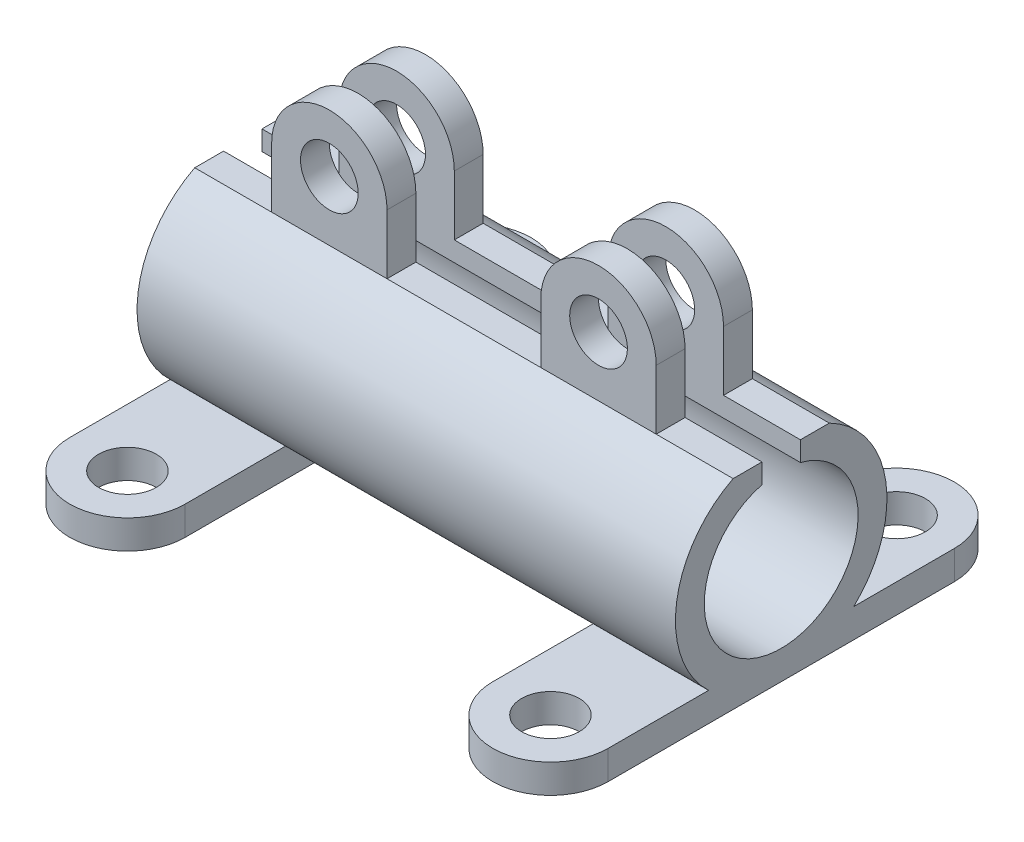
from build123d import *

# Parameters (mm, degrees)
SKETCH2_R               = 15
BOSS_EXTRUDE1_DEPTH     = 15
BOSS_EXTRUDE1_2_DEPTH   = 15
BOSS_EXTRUDE2_DEPTH     = 140
CUT_EXTRUDE2_DEPTH      = 261.480325553
CUT_EXTRUDE2_DEPTH_BACK = 261.480325553
SKETCH4_R               = 15


with BuildPart() as part:
    # Sketch2 → Boss-Extrude1 (new body)
    with BuildSketch(Plane(origin=(0, 0, 0), x_dir=(1, 0, 0), z_dir=(0, 1, 0))):
        with BuildLine():
            Line((-140, -90), (-140, 90))
            ThreePointArc((-140, 90), (-110, 120), (-80, 90))
            Line((-80, 90), (-80, -90))
            ThreePointArc((-80, -90), (-110, -120), (-140, -90))
        make_face()
        with Locations(Location((-110, 90, 0), (0, 0, 270))):
            Circle(SKETCH2_R, mode=Mode.SUBTRACT)
        with Locations(Location((-110, -90, 0), (0, 0, 270))):
            Circle(SKETCH2_R, mode=Mode.SUBTRACT)
    extrude(amount=BOSS_EXTRUDE1_DEPTH)



with BuildPart() as body_2:
    # Sketch2 → Boss-Extrude1 2 (new body)
    with BuildSketch(Plane(origin=(0, 0, 0), x_dir=(1, 0, 0), z_dir=(0, 1, 0))):
        with BuildLine():
            Line((140, -90), (140, 90))
            ThreePointArc((140, 90), (110, 120), (80, 90))
            Line((80, 90), (80, -90))
            ThreePointArc((80, -90), (110, -120), (140, -90))
        make_face()
        with Locations(Location((110, -90, 0), (0, 0, 90))):
            Circle(SKETCH2_R, mode=Mode.SUBTRACT)
        with Locations(Location((110, 90, 0), (0, 0, 90))):
            Circle(SKETCH2_R, mode=Mode.SUBTRACT)
    extrude(amount=BOSS_EXTRUDE1_2_DEPTH)


with BuildPart() as part_1:
    add(part.part)

    add(body_2.part)  # Boss-Extrude2 merges body 2
    # Sketch3 → Boss-Extrude2 (add, symmetric)
    with BuildSketch(Plane(origin=(0, 0, 0), x_dir=(0, 0, -1), z_dir=(1, 0, 0))):
        with BuildLine():
            Line((-10, 165), (-10, 93.729833462))
            ThreePointArc((-10, 93.729833462), (0, 15), (10, 93.729833462))
            Line((10, 93.729833462), (10, 165))
            Line((10, 165), (25, 165))
            Line((25, 165), (25, 103.989794856))
            ThreePointArc((25, 103.989794856), (0, 0), (-25, 103.989794856))
            Line((-25, 103.989794856), (-25, 165))
            Line((-25, 165), (-10, 165))
        make_face()
    extrude(amount=BOSS_EXTRUDE2_DEPTH, both=True)

    # Sketch4 → Cut-Extrude2 (cut, two sides: drawn at the far end of the back side and taken through both)
    with BuildSketch(Plane.XY.offset(25).offset(-CUT_EXTRUDE2_DEPTH_BACK)):
        with BuildLine():
            Line((-140, 165), (-140, 103.989794856))
            Line((-140, 103.989794856), (-100, 103.989794856))
            Line((-100, 103.989794856), (-100, 135))
            ThreePointArc((-100, 135), (-91.213203436, 156.213203436), (-70, 165))
            Line((-70, 165), (-140, 165))
        make_face()
        with Locations(Location((-70, 135, 0), (0, 0, 90))):
            Circle(SKETCH4_R)
        with BuildLine():
            Line((-40, 135), (-40, 103.989794856))
            Line((-40, 103.989794856), (0, 103.989794856))
            Line((0, 103.989794856), (0, 165))
            Line((0, 165), (-70, 165))
            ThreePointArc((-70, 165), (-48.786796564, 156.213203436), (-40, 135))
        make_face()
        with BuildLine():
            Line((0, 165), (0, 103.989794856))
            Line((0, 103.989794856), (40, 103.989794856))
            Line((40, 103.989794856), (40, 135))
            ThreePointArc((40, 135), (48.786796564, 156.213203436), (70, 165))
            Line((70, 165), (0, 165))
        make_face()
        with Locations(Location((70, 135, 0), (0, 0, 90))):
            Circle(SKETCH4_R)
        with BuildLine():
            Line((140, 165), (70, 165))
            ThreePointArc((70, 165), (91.213203436, 156.213203436), (100, 135))
            Line((100, 135), (100, 103.989794856))
            Line((100, 103.989794856), (140, 103.989794856))
            Line((140, 103.989794856), (140, 165))
        make_face()
    extrude(amount=CUT_EXTRUDE2_DEPTH + CUT_EXTRUDE2_DEPTH_BACK, mode=Mode.SUBTRACT)


solid = part_1.part
